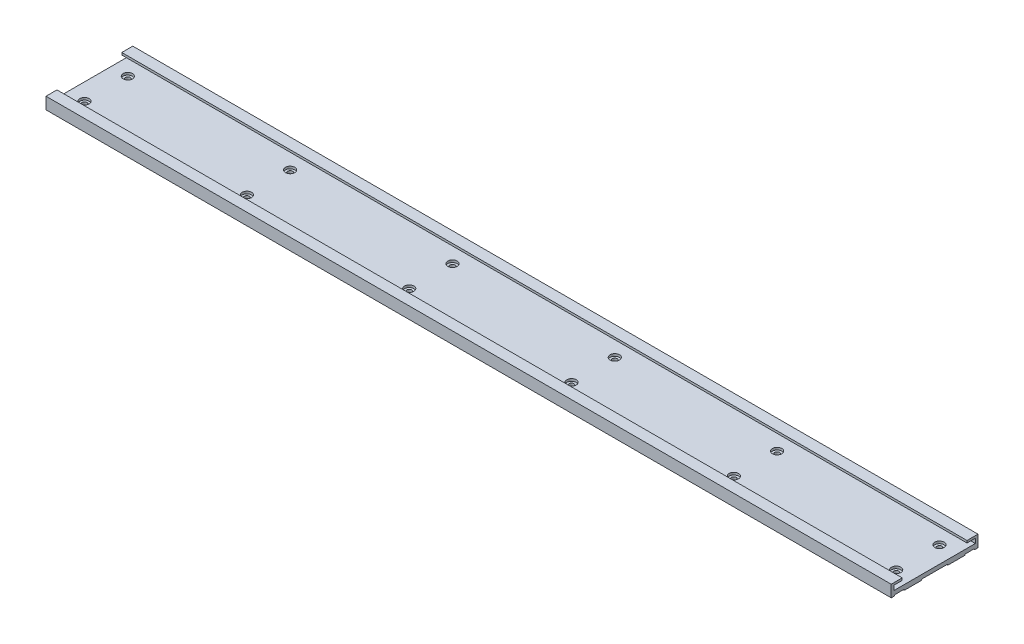
from build123d import *

# Parameters (mm, degrees)
SKETCH1_W           = 781.05
SKETCH1_H           = 80.1751
BOSS_EXTRUDE1_DEPTH = 10.922
SKETCH2_W           = 781.05
SKETCH2_H           = 9.0297
SKETCH2_H_2         = 24.4221
CUT_EXTRUDE1_DEPTH  = 0.9144
FILLET1_R           = 0.762
CUT_EXTRUDE2_DEPTH  = 783.154335313
SKETCH6_R           = 2.286
CUT_EXTRUDE4_DEPTH  = 393.627440931
LPATTERN1_COUNT     = 5
LPATTERN1_PITCH     = 150
LPATTERN2_COUNT     = 4
LPATTERN2_PITCH     = 150
SKETCH7_R           = 4.318
CUT_EXTRUDE5_DEPTH  = 2.159
LPATTERN3_COUNT     = 6
LPATTERN3_PITCH     = 150


with BuildPart() as part:
    # Sketch1 → Boss-Extrude1 (new body)
    with BuildSketch(Plane(origin=(0, 0, 0), x_dir=(1, 0, 0), z_dir=(0, 1, 0))):
        Rectangle(SKETCH1_W, SKETCH1_H)
    extrude(amount=BOSS_EXTRUDE1_DEPTH)

    # Sketch2 → Cut-Extrude1 (cut)
    with BuildSketch(Plane.XZ):
        with Locations((0, 32.4612)):
            Rectangle(SKETCH2_W, SKETCH2_H)
        Rectangle(SKETCH2_W, SKETCH2_H_2)
        with Locations((0, -32.4612)):
            Rectangle(SKETCH2_W, SKETCH2_H)
    extrude(amount=-CUT_EXTRUDE1_DEPTH, mode=Mode.SUBTRACT)

    # Fillet1
    fillet1_edges = [part.edges().sort_by_distance(p)[0] for p in [
        (0, 0.9144, 27.94635),
        (0, 0.9144, 36.97605),
        (0, 0.9144, -12.21105),
        (0, 0.9144, 12.21105),
        (0, 0.9144, -36.97605),
        (0, 0.9144, -27.94635),
    ]]
    fillet(fillet1_edges, radius=FILLET1_R)

    # Sketch3 → Cut-Extrude2 (cut, through all)
    with BuildSketch(Plane(origin=(390.525, 0, 0), x_dir=(0, 0, -1), z_dir=(1, 0, 0))):
        Polygon((-29.92755, 10.922), (-29.92755, 8.89), (-37.67455, 8.89), (-37.67455, 4.6355), (37.67455, 4.6355), (37.67455, 8.89), (29.92755, 8.89), (29.92755, 10.922), align=None)
    extrude(amount=-CUT_EXTRUDE2_DEPTH, mode=Mode.SUBTRACT)

    # Sketch6 → Cut-Extrude4 (cut, through all)
    with BuildSketch(Plane(origin=(0, 4.6355, 0), x_dir=(1, 0, 0), z_dir=(0, 1, 0))):
        with Locations(Location((75, -20, 0), (0, 0, 270))):
            Circle(SKETCH6_R)
        with Locations(Location((75, 20, 0), (0, 0, 270))):
            Circle(SKETCH6_R)
    cut_extrude4 = extrude(amount=-CUT_EXTRUDE4_DEPTH, mode=Mode.SUBTRACT)

    # LPattern1: Cut-Extrude4 ×5
    with Locations(*[(i * LPATTERN1_PITCH, 0, 0) for i in range(1, LPATTERN1_COUNT)]):
        add(cut_extrude4, mode=Mode.SUBTRACT)

    # LPattern2: Cut-Extrude4 ×4
    with Locations(*[(-i * LPATTERN2_PITCH, 0, 0) for i in range(1, LPATTERN2_COUNT)]):
        add(cut_extrude4, mode=Mode.SUBTRACT)

    # Sketch7 → Cut-Extrude5 (cut)
    with BuildSketch(Plane(origin=(0, 4.6355, 0), x_dir=(1, 0, 0), z_dir=(0, 1, 0))):
        with Locations(Location((375, -20, 0), (0, 0, 270))):
            Circle(SKETCH7_R)
        with Locations(Location((375, 20, 0), (0, 0, 270))):
            Circle(SKETCH7_R)
    cut_extrude5 = extrude(amount=-CUT_EXTRUDE5_DEPTH, mode=Mode.SUBTRACT)

    # LPattern3: Cut-Extrude5 ×6
    with Locations(*[(-i * LPATTERN3_PITCH, 0, 0) for i in range(1, LPATTERN3_COUNT)]):
        add(cut_extrude5, mode=Mode.SUBTRACT)


solid = part.part
